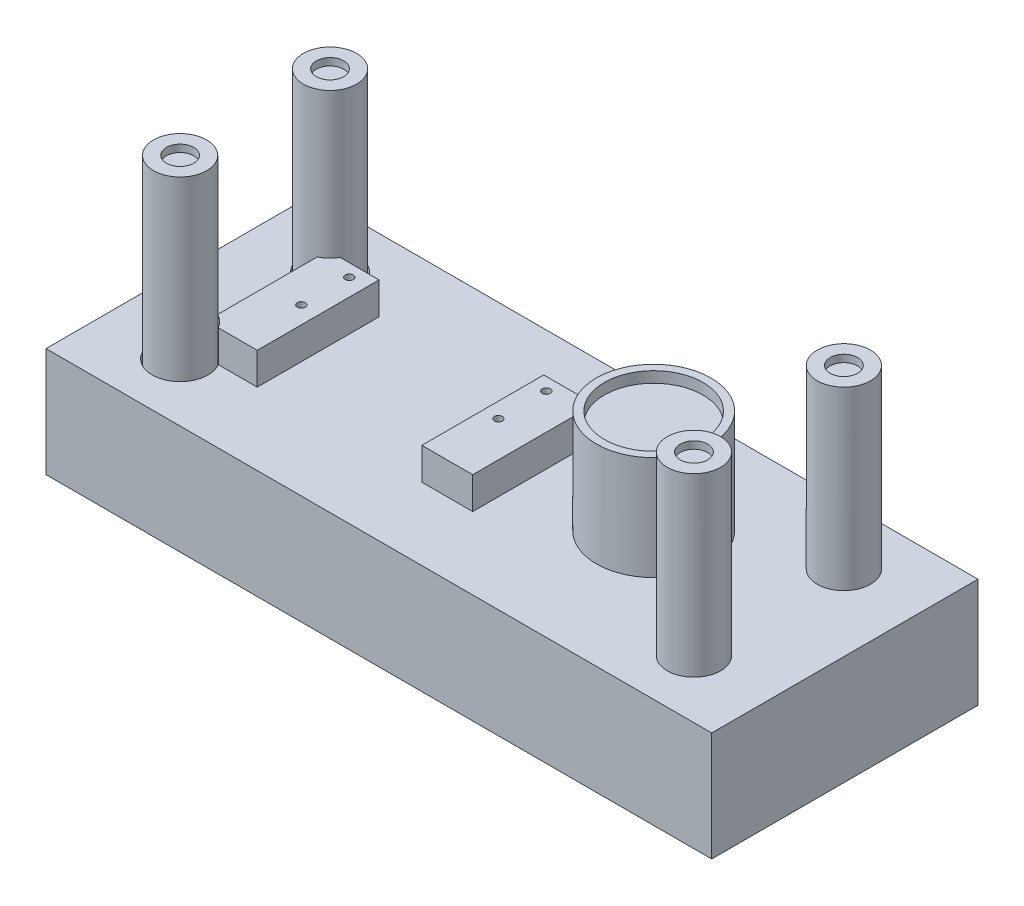
from build123d import *

# Parameters (mm, degrees)
SKETCH1_W                = 250
SKETCH1_H                = 100
BOSS_EXTRUDE1_DEPTH      = 41
SKETCH1_4_W              = 19.09
SKETCH1_4_H              = 45.76
BOSS_EXTRUDE2_DEPTH      = 12
SKETCH1_5_R              = 21.5
SKETCH1_5_R_2            = 18.55
BOSS_EXTRUDE3_DEPTH      = 39
SKETCH1_6_R              = 18.55
BOSS_EXTRUDE4_DEPTH      = 34.9
CUT_EXTRUDE1_START       = -5
SKETCH1_9_R              = 10
SKETCH1_9_R_2            = 5.15
CUT_EXTRUDE1_DEPTH       = 5
SKETCH1_10_R             = 10
SKETCH1_10_R_2           = 5.15
BOSS_EXTRUDE7_DEPTH      = 66.2
BOSS_EXTRUDE8_DEPTH      = 66.2
BOSS_EXTRUDE8_DEPTH_BACK = 5
SKETCH1_11_R             = 10
SKETCH1_11_R_2           = 5.15
CUT_EXTRUDE2_START       = 66.2
SKETCH1_12_R             = 5.15
CUT_EXTRUDE2_DEPTH       = 2.75
SKETCH3_R                = 1.5
CUT_EXTRUDE3_DEPTH       = 12
SKETCH4_W                = 150
SKETCH4_H                = 49.5
CUT_EXTRUDE4_DEPTH       = 31


with BuildPart() as part:
    # Sketch1 → Boss-Extrude1 (new body)
    with BuildSketch(Plane(origin=(0, 0, 0), x_dir=(1, 0, 0), z_dir=(0, 1, 0))):
        Rectangle(SKETCH1_W, SKETCH1_H)
    extrude(amount=-BOSS_EXTRUDE1_DEPTH)

    # Sketch1<4> → Boss-Extrude2 (add)
    with BuildSketch(Plane(origin=(0, 0, 0), x_dir=(1, 0, 0), z_dir=(0, 1, 0))):
        with BuildLine():
            Line((-72.79, 22.88), (-87.40331, 22.88))
            ThreePointArc((-87.40331, 22.88), (-89.331615, 20.463708), (-91.88, 18.713688))
            Line((-91.88, 18.713688), (-91.88, -18.713688))
            ThreePointArc((-91.88, -18.713688), (-89.331615, -20.463708), (-87.40331, -22.88))
            Line((-87.40331, -22.88), (-72.79, -22.88))
            Line((-72.79, -22.88), (-72.79, 22.88))
        make_face()
        with Locations((-1.415, 0)):
            Rectangle(SKETCH1_4_W, SKETCH1_4_H)
    extrude(amount=BOSS_EXTRUDE2_DEPTH)

    # Sketch1<5> → Boss-Extrude3 (add)
    with BuildSketch(Plane(origin=(0, 0, 0), x_dir=(1, 0, 0), z_dir=(0, 1, 0))):
        with Locations(Location((48.387034, 4.81425, 0), (0, 0, 90))):
            Circle(SKETCH1_5_R)
        with Locations(Location((48.387034, 4.81425, 0), (0, 0, 270))):
            Circle(SKETCH1_5_R_2, mode=Mode.SUBTRACT)
    extrude(amount=BOSS_EXTRUDE3_DEPTH)

    # Sketch1<6> → Boss-Extrude4 (add)
    with BuildSketch(Plane(origin=(0, 0, 0), x_dir=(1, 0, 0), z_dir=(0, 1, 0))):
        with Locations(Location((48.387034, 4.81425, 0), (0, 0, 270))):
            Circle(SKETCH1_6_R)
    extrude(amount=BOSS_EXTRUDE4_DEPTH)

    # Sketch1<9> → Cut-Extrude1 (cut)
    # profile 1 of 12: a face of its own
    with BuildSketch(Plane(origin=(0, 0, 0), x_dir=(1, 0, 0), z_dir=(0, 1, 0)).offset(CUT_EXTRUDE1_START)):
        with BuildLine():
            ThreePointArc((-87.40331, -22.88), (-89.331615, -20.463708), (-91.88, -18.713688))
            Line((-91.88, -18.713688), (-91.88, -19.273403))
            ThreePointArc((-91.88, -19.273403), (-89.689537, -20.813674), (-87.986347, -22.88))
            Line((-87.986347, -22.88), (-87.40331, -22.88))
        make_face()
    # profile 2 of 12: a face of its own
    with BuildSketch(Plane(origin=(0, 0, 0), x_dir=(1, 0, 0), z_dir=(0, 1, 0)).offset(CUT_EXTRUDE1_START)):
        with BuildLine():
            Line((-91.88, -19.273403), (-91.88, -18.713688))
            ThreePointArc((-91.88, -18.713688), (-105.390125, -33.71316), (-85.985, -28.15))
            ThreePointArc((-85.985, -28.15), (-86.345775, -25.421241), (-87.40331, -22.88))
            Line((-87.40331, -22.88), (-87.986347, -22.88))
            ThreePointArc((-87.986347, -22.88), (-86.867658, -25.410158), (-86.485, -28.15))
            ThreePointArc((-86.485, -28.15), (-105.030467, -33.343746), (-91.88, -19.273403))
        make_face()
    # profile 3 of 12: a face of its own
    with BuildSketch(Plane(origin=(0, 0, 0), x_dir=(1, 0, 0), z_dir=(0, 1, 0)).offset(CUT_EXTRUDE1_START)):
        with Locations((-96.485, -28.15)):
            Circle(SKETCH1_9_R)
        with Locations((-96.485, -28.15)):
            Circle(SKETCH1_9_R_2, mode=Mode.SUBTRACT)
    # profile 4 of 12: a face of its own
    with BuildSketch(Plane(origin=(0, 0, 0), x_dir=(1, 0, 0), z_dir=(0, 1, 0)).offset(CUT_EXTRUDE1_START)):
        with Locations((-96.485, -28.15)):
            Circle(SKETCH1_9_R_2)
    # profile 5 of 12: a face of its own
    with BuildSketch(Plane(origin=(0, 0, 0), x_dir=(1, 0, 0), z_dir=(0, 1, 0)).offset(CUT_EXTRUDE1_START)):
        with BuildLine():
            ThreePointArc((-86.485, 28.15), (-86.867658, 25.410158), (-87.986347, 22.88))
            Line((-87.986347, 22.88), (-87.40331, 22.88))
            ThreePointArc((-87.40331, 22.88), (-86.345775, 25.421241), (-85.985, 28.15))
            ThreePointArc((-85.985, 28.15), (-105.390125, 33.71316), (-91.88, 18.713688))
            Line((-91.88, 18.713688), (-91.88, 19.273403))
            ThreePointArc((-91.88, 19.273403), (-105.030467, 33.343746), (-86.485, 28.15))
        make_face()
    # profile 6 of 12: a face of its own
    with BuildSketch(Plane(origin=(0, 0, 0), x_dir=(1, 0, 0), z_dir=(0, 1, 0)).offset(CUT_EXTRUDE1_START)):
        with BuildLine():
            Line((-87.40331, 22.88), (-87.986347, 22.88))
            ThreePointArc((-87.986347, 22.88), (-89.689537, 20.813674), (-91.88, 19.273403))
            Line((-91.88, 19.273403), (-91.88, 18.713688))
            ThreePointArc((-91.88, 18.713688), (-89.331615, 20.463708), (-87.40331, 22.88))
        make_face()
    # profile 7 of 12: a face of its own
    with BuildSketch(Plane(origin=(0, 0, 0), x_dir=(1, 0, 0), z_dir=(0, 1, 0)).offset(CUT_EXTRUDE1_START)):
        with Locations((-96.485, 28.15)):
            Circle(SKETCH1_9_R)
        with Locations((-96.485, 28.15)):
            Circle(SKETCH1_9_R_2, mode=Mode.SUBTRACT)
    # profile 8 of 12: a face of its own
    with BuildSketch(Plane(origin=(0, 0, 0), x_dir=(1, 0, 0), z_dir=(0, 1, 0)).offset(CUT_EXTRUDE1_START)):
        with Locations((-96.485, 28.15)):
            Circle(SKETCH1_9_R_2)
    # profile 9 of 12: a face of its own
    with BuildSketch(Plane(origin=(0, 0, 0), x_dir=(1, 0, 0), z_dir=(0, 1, 0)).offset(CUT_EXTRUDE1_START)):
        with BuildLine():
            ThreePointArc((-87.40331, -22.88), (-89.331615, -20.463708), (-91.88, -18.713688))
            Line((-91.88, -18.713688), (-91.88, -19.273403))
            ThreePointArc((-91.88, -19.273403), (-89.689537, -20.813674), (-87.986347, -22.88))
            Line((-87.986347, -22.88), (-87.40331, -22.88))
        make_face()
    # profile 10 of 12: a face of its own
    with BuildSketch(Plane(origin=(0, 0, 0), x_dir=(1, 0, 0), z_dir=(0, 1, 0)).offset(CUT_EXTRUDE1_START)):
        with BuildLine():
            Line((-91.88, -19.273403), (-91.88, -18.713688))
            ThreePointArc((-91.88, -18.713688), (-105.390125, -33.71316), (-85.985, -28.15))
            ThreePointArc((-85.985, -28.15), (-86.345775, -25.421241), (-87.40331, -22.88))
            Line((-87.40331, -22.88), (-87.986347, -22.88))
            ThreePointArc((-87.986347, -22.88), (-86.867658, -25.410158), (-86.485, -28.15))
            ThreePointArc((-86.485, -28.15), (-105.030467, -33.343746), (-91.88, -19.273403))
        make_face()
    # profile 11 of 12: a face of its own
    with BuildSketch(Plane(origin=(0, 0, 0), x_dir=(1, 0, 0), z_dir=(0, 1, 0)).offset(CUT_EXTRUDE1_START)):
        with BuildLine():
            ThreePointArc((-86.485, 28.15), (-86.867658, 25.410158), (-87.986347, 22.88))
            Line((-87.986347, 22.88), (-87.40331, 22.88))
            ThreePointArc((-87.40331, 22.88), (-86.345775, 25.421241), (-85.985, 28.15))
            ThreePointArc((-85.985, 28.15), (-105.390125, 33.71316), (-91.88, 18.713688))
            Line((-91.88, 18.713688), (-91.88, 19.273403))
            ThreePointArc((-91.88, 19.273403), (-105.030467, 33.343746), (-86.485, 28.15))
        make_face()
    # profile 12 of 12: a face of its own
    with BuildSketch(Plane(origin=(0, 0, 0), x_dir=(1, 0, 0), z_dir=(0, 1, 0)).offset(CUT_EXTRUDE1_START)):
        with BuildLine():
            Line((-87.40331, 22.88), (-87.986347, 22.88))
            ThreePointArc((-87.986347, 22.88), (-89.689537, 20.813674), (-91.88, 19.273403))
            Line((-91.88, 19.273403), (-91.88, 18.713688))
            ThreePointArc((-91.88, 18.713688), (-89.331615, 20.463708), (-87.40331, 22.88))
        make_face()
    extrude(amount=CUT_EXTRUDE1_DEPTH, mode=Mode.SUBTRACT)

    # Sketch1<10> → Boss-Extrude7 (add)
    # profile 1 of 4: a face of its own
    with BuildSketch(Plane(origin=(0, 0, 0), x_dir=(1, 0, 0), z_dir=(0, 1, 0))):
        with Locations(Location((96.485, -28.15, 0), (0, 0, 90))):
            Circle(SKETCH1_10_R)
        with Locations((96.485, -28.15)):
            Circle(SKETCH1_10_R_2, mode=Mode.SUBTRACT)
    # profile 2 of 4: a face of its own
    with BuildSketch(Plane(origin=(0, 0, 0), x_dir=(1, 0, 0), z_dir=(0, 1, 0))):
        with Locations((96.485, -28.15)):
            Circle(SKETCH1_10_R_2)
    # profile 3 of 4: a face of its own
    with BuildSketch(Plane(origin=(0, 0, 0), x_dir=(1, 0, 0), z_dir=(0, 1, 0))):
        with Locations(Location((96.485, 28.15, 0), (0, 0, 90))):
            Circle(SKETCH1_10_R)
        with Locations((96.485, 28.15)):
            Circle(SKETCH1_10_R_2, mode=Mode.SUBTRACT)
    # profile 4 of 4: a face of its own
    with BuildSketch(Plane(origin=(0, 0, 0), x_dir=(1, 0, 0), z_dir=(0, 1, 0))):
        with Locations((96.485, 28.15)):
            Circle(SKETCH1_10_R_2)
    extrude(amount=BOSS_EXTRUDE7_DEPTH)


with BuildPart() as body_2:
    # Sketch1<11> → Boss-Extrude8 (new, two sides: drawn at the far end of the back side and taken through both)
    # profile 1 of 4: a face of its own
    with BuildSketch(Plane(origin=(0, 0, 0), x_dir=(1, 0, 0), z_dir=(0, 1, 0)).offset(-BOSS_EXTRUDE8_DEPTH_BACK)):
        with Locations(Location((-96.485, -28.15, 0), (0, 0, 270))):
            Circle(SKETCH1_11_R)
        with Locations((-96.485, -28.15)):
            Circle(SKETCH1_11_R_2, mode=Mode.SUBTRACT)
    # profile 2 of 4: a face of its own
    with BuildSketch(Plane(origin=(0, 0, 0), x_dir=(1, 0, 0), z_dir=(0, 1, 0)).offset(-BOSS_EXTRUDE8_DEPTH_BACK)):
        with Locations((-96.485, -28.15)):
            Circle(SKETCH1_11_R_2)
    # profile 3 of 4: a face of its own
    with BuildSketch(Plane(origin=(0, 0, 0), x_dir=(1, 0, 0), z_dir=(0, 1, 0)).offset(-BOSS_EXTRUDE8_DEPTH_BACK)):
        with Locations(Location((-96.485, 28.15, 0), (0, 0, 270))):
            Circle(SKETCH1_11_R)
        with Locations((-96.485, 28.15)):
            Circle(SKETCH1_11_R_2, mode=Mode.SUBTRACT)
    # profile 4 of 4: a face of its own
    with BuildSketch(Plane(origin=(0, 0, 0), x_dir=(1, 0, 0), z_dir=(0, 1, 0)).offset(-BOSS_EXTRUDE8_DEPTH_BACK)):
        with Locations((-96.485, 28.15)):
            Circle(SKETCH1_11_R_2)
    extrude(amount=BOSS_EXTRUDE8_DEPTH + BOSS_EXTRUDE8_DEPTH_BACK)


with BuildPart() as cut_extrude2_tool:
    # Sketch1<12> → Cut-Extrude2 (new body)
    with BuildSketch(Plane(origin=(0, 0, 0), x_dir=(1, 0, 0), z_dir=(0, 1, 0)).offset(CUT_EXTRUDE2_START)):
        with Locations(Location((-96.485, 28.15, 0), (0, 0, 270))):
            Circle(SKETCH1_12_R)
        with Locations(Location((-96.485, -28.15, 0), (0, 0, 270))):
            Circle(SKETCH1_12_R)
        with Locations(Location((96.485, 28.15, 0), (0, 0, 270))):
            Circle(SKETCH1_12_R)
        with Locations(Location((96.485, -28.15, 0), (0, 0, 270))):
            Circle(SKETCH1_12_R)
    extrude(amount=-CUT_EXTRUDE2_DEPTH)


with BuildPart() as part_1:
    add(part.part)

    # Cut-Extrude2: cut by cut_extrude2_tool
    add(cut_extrude2_tool.part, mode=Mode.SUBTRACT)

    # Sketch3 → Cut-Extrude3 (cut)
    with BuildSketch(Plane(origin=(0, 12, 0), x_dir=(1, 0, 0), z_dir=(0, 1, 0))):
        with Locations(Location((-79.254798, 18.133761, 0), (0, 0, 270))):
            Circle(SKETCH3_R)
        with Locations(Location((-79.254798, 0.133761, 0), (0, 0, 270))):
            Circle(SKETCH3_R)
        with Locations(Location((-5.254798, 18.133761, 0), (0, 0, 270))):
            Circle(SKETCH3_R)
        with Locations(Location((-5.254798, 0.133761, 0), (0, 0, 270))):
            Circle(SKETCH3_R)
    extrude(amount=-CUT_EXTRUDE3_DEPTH, mode=Mode.SUBTRACT)

    # Sketch4 → Cut-Extrude4 (cut)
    with BuildSketch(Plane.XZ.offset(41)):
        with Locations((-30, -5.25)):
            Rectangle(SKETCH4_W, SKETCH4_H)
    extrude(amount=-CUT_EXTRUDE4_DEPTH, mode=Mode.SUBTRACT)


with BuildPart() as body_2_1:
    add(body_2.part)

    # Cut-Extrude2: cut by cut_extrude2_tool
    add(cut_extrude2_tool.part, mode=Mode.SUBTRACT)


solid = Compound([part_1.part, body_2_1.part])
